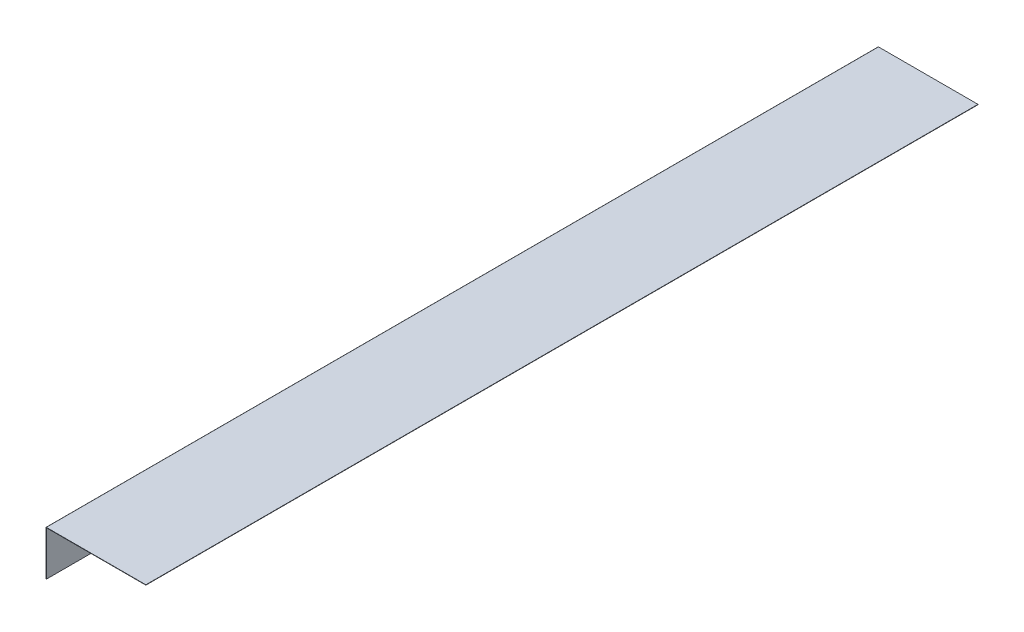
from build123d import *

# Parameters (mm, degrees)
BOSS_EXTRUDE1_DEPTH = 2500
FILLET1_R           = 1


with BuildPart() as part:
    # Sketch1 → Boss-Extrude1 (new body)
    with BuildSketch(Plane.XY):
        Polygon((0, 0), (0, 135), (300, 135), (300, 134), (1, 134), (1, 0), align=None)
    extrude(amount=BOSS_EXTRUDE1_DEPTH)

    # Fillet1
    fillet1_edges = [part.edges().sort_by_distance(p)[0] for p in [
        (0, 135, 1250),
        (1, 134, 1250),
    ]]
    fillet(fillet1_edges, radius=FILLET1_R)


solid = part.part
